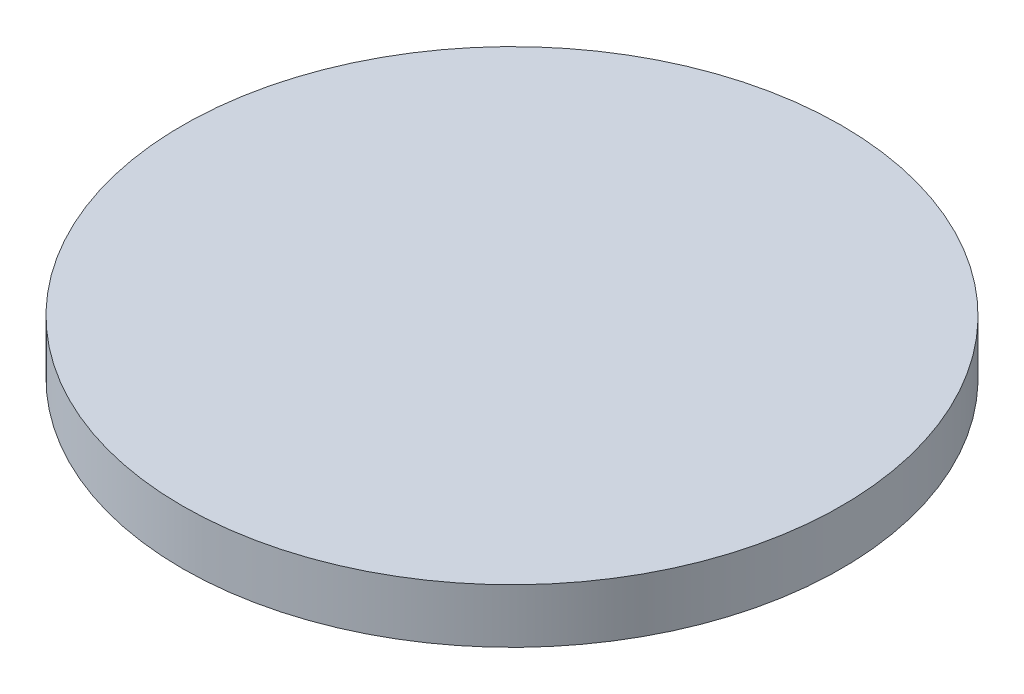
from build123d import *

# Parameters (mm, degrees)
SKETCH1_R           = 243
BOSS_EXTRUDE1_DEPTH = 40
SHELL1_T            = -10


with BuildPart() as part:
    # Sketch1 → Boss-Extrude1 (new body)
    with BuildSketch(Plane(origin=(0, 0, 0), x_dir=(1, 0, 0), z_dir=(0, 1, 0))):
        with Locations(Location((0, 0, 0), (0, 0, 270))):
            Circle(SKETCH1_R)
    extrude(amount=BOSS_EXTRUDE1_DEPTH)

    # Shell1
    shell1_openings = [part.faces().sort_by_distance(p)[0] for p in [
        (0, 0, 0),
    ]]
    offset(amount=SHELL1_T, openings=shell1_openings, kind=Kind.INTERSECTION)


solid = part.part
